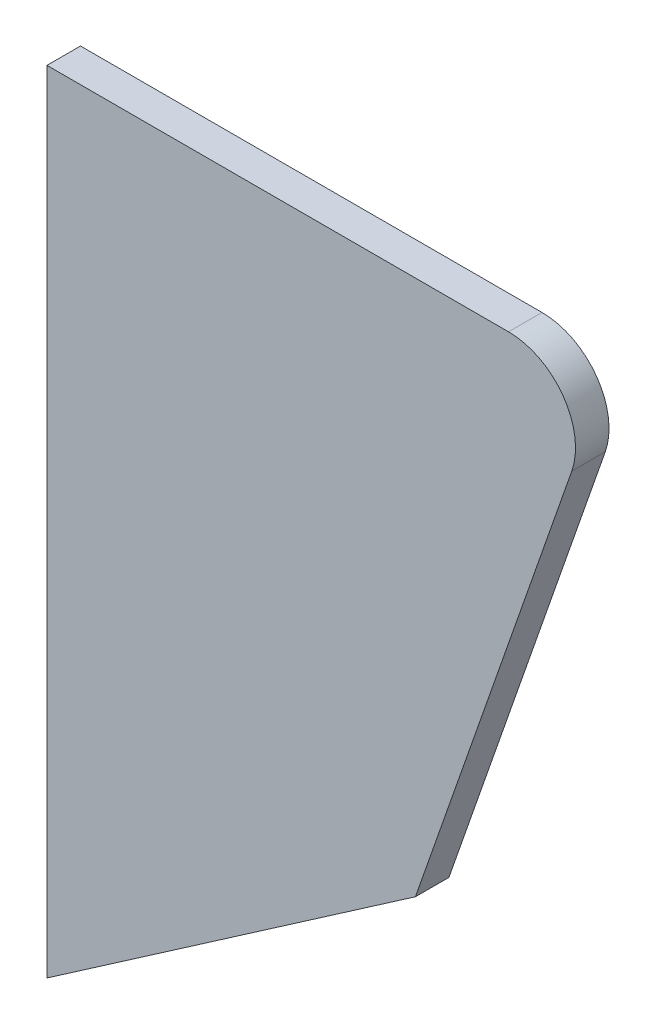
from build123d import *

# Parameters (mm, degrees)
BOSS_EXTRUDE1_DEPTH = 5


with BuildPart() as part:
    # Sketch1 → Boss-Extrude1 (new body)
    with BuildSketch(Plane.XY):
        with BuildLine():
            Line((-41.5, -38), (-41.5, 80))
            Line((-41.5, 80), (27.40518995, 80))
            ThreePointArc((27.40518995, 80), (35.56101739, 75.786404649), (36.843773513, 66.696495753))
            Line((36.843773513, 66.696495753), (13.5, 0))
            Line((13.5, 0), (-41.5, -38))
        make_face()
    extrude(amount=BOSS_EXTRUDE1_DEPTH)


solid = part.part
